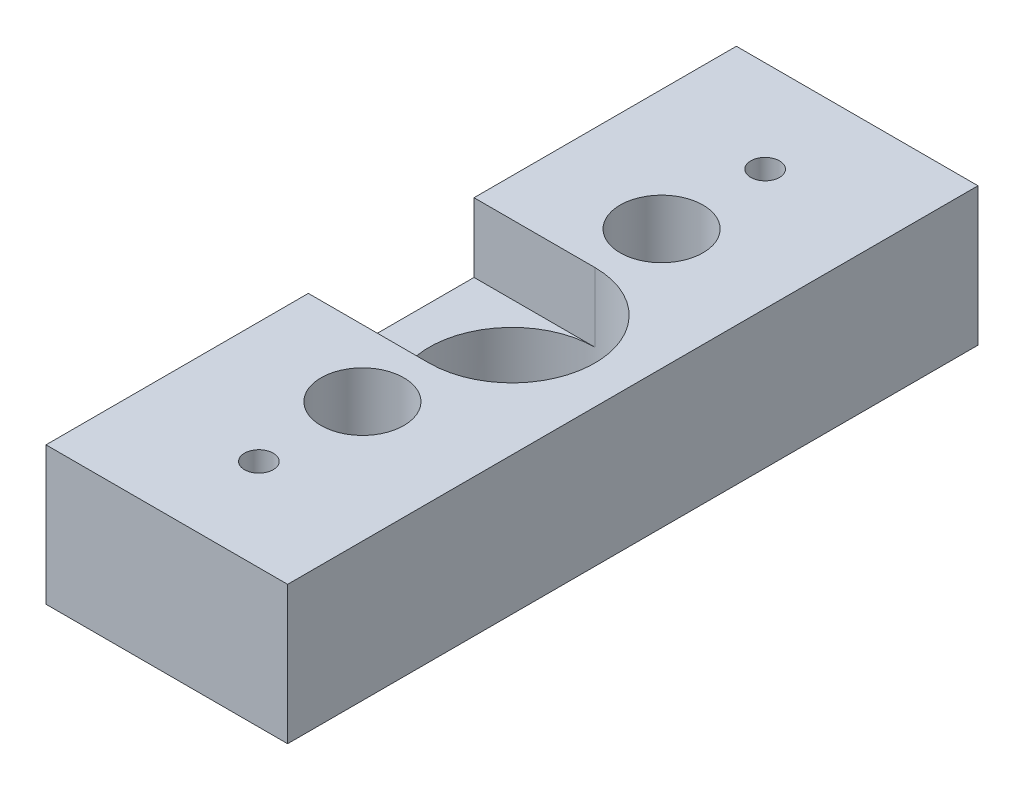
from build123d import *

# Parameters (mm, degrees)
BOSS_EXTRUDE1_DEPTH = 6
M1_6_TAPPED_HOLE1_D = 1.25
SKETCH6_R           = 3.6
CUT_EXTRUDE1_DEPTH  = 20
SKETCH7_W           = 5.25
SKETCH7_H           = 7.2
CUT_EXTRUDE2_DEPTH  = 3


with BuildPart() as part:
    # Sketch1 → Boss-Extrude1 (new body)
    with BuildSketch(Plane(origin=(0, 0, 0), x_dir=(1, 0, 0), z_dir=(0, 1, 0))):
        Polygon((6, 2), (6, -13), (-4.5, -13), (-4.5, -2), (-4.5, 2), (1.5, 2), align=None)
    boss_extrude1 = extrude(amount=BOSS_EXTRUDE1_DEPTH)

    # Sketch3 → CSK SLOT for M1.6 Countersunk Flat Head Screw1 (revolve, cut)
    with BuildSketch(Plane(origin=(0.75, 6, 4.5), x_dir=(0, 0, 1), z_dir=(1, 0, 0))):
        Polygon((0, 0), (0, 6), (0.9, 6), (0.9, 4.9), (1.8, 4), (1.8, 0), align=None)
    csk_slot_for_m1_6_countersunk_flat_head = revolve(axis=Axis((0.75, 12.35, 4.5), (0, -1, 0)), mode=Mode.SUBTRACT)

    # M1.6 Tapped Hole1 (through all)
    with Locations(Plane(origin=(0, 6, 0), x_dir=(1, 0, 0), z_dir=(0, 1, 0))):
        with Locations((0.75, -9)):
            m1_6_tapped_hole1 = Hole(M1_6_TAPPED_HOLE1_D / 2)

    # Mirror1: Boss-Extrude1, CSK SLOT for M1.6 Countersunk Flat Head Screw1, M1.6 Tapped Hole1 across plane
    add(boss_extrude1.mirror(Plane(origin=(0, 0, -2), x_dir=(1, 0, 0), z_dir=(0, 0, -1))))
    add(csk_slot_for_m1_6_countersunk_flat_head.mirror(Plane(origin=(0, 0, -2), x_dir=(1, 0, 0), z_dir=(0, 0, -1))), mode=Mode.SUBTRACT)
    add(m1_6_tapped_hole1.mirror(Plane(origin=(0, 0, -2), x_dir=(1, 0, 0), z_dir=(0, 0, -1))), mode=Mode.SUBTRACT)

    # Sketch6 → Cut-Extrude1 (cut, through all)
    with BuildSketch(Plane(origin=(0, 6, 0), x_dir=(1, 0, 0), z_dir=(0, 1, 0))):
        with Locations(Location((0.75, 2, 0), (0, 0, 270))):
            Circle(SKETCH6_R)
    extrude(amount=-CUT_EXTRUDE1_DEPTH, mode=Mode.SUBTRACT)

    # Sketch7 → Cut-Extrude2 (cut)
    with BuildSketch(Plane(origin=(0, 6, 0), x_dir=(1, 0, 0), z_dir=(0, 1, 0))):
        with Locations((-1.875, 2)):
            Rectangle(SKETCH7_W, SKETCH7_H)
    extrude(amount=-CUT_EXTRUDE2_DEPTH, mode=Mode.SUBTRACT)


solid = part.part
